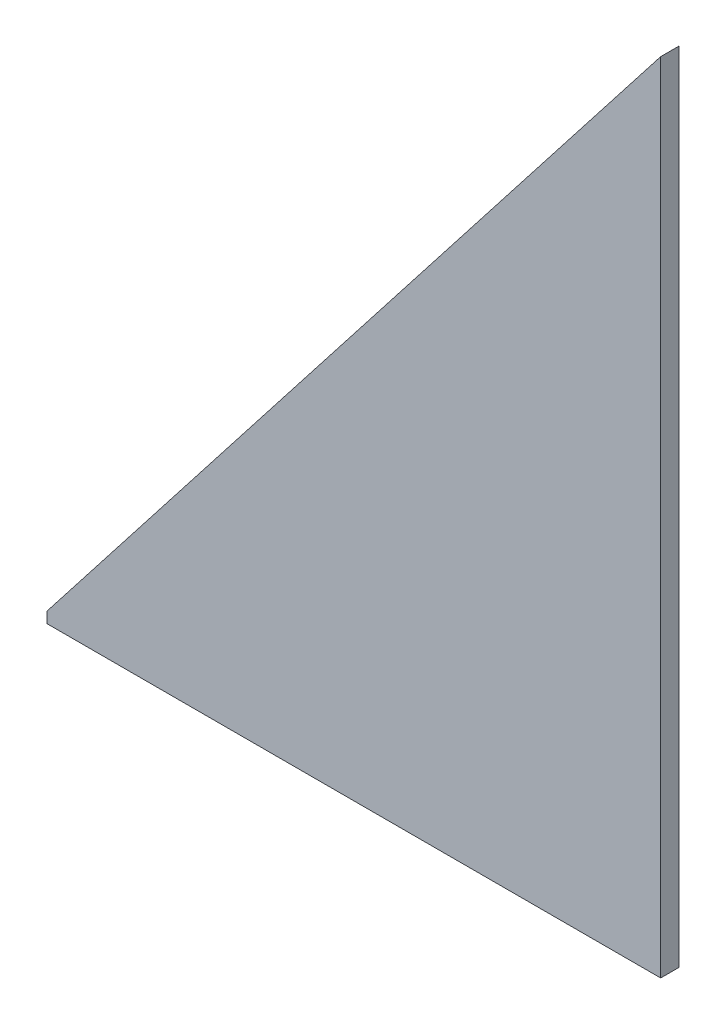
from build123d import *

# Parameters (mm, degrees)
SKETCH_1_W          = 100
SKETCH_1_H          = 130
EXTRUDE_1_DEPTH     = 3
CUT_EXTRUDE_5_DEPTH = 127.381402242


with BuildPart() as part:
    # 草图1 → 凸台-拉伸1 (new body)
    with BuildSketch(Plane.XY):
        with Locations((-27.81018426, -34.543126624)):
            Rectangle(SKETCH_1_W, SKETCH_1_H)
    extrude(amount=EXTRUDE_1_DEPTH)

    # 草图2 → 切除-拉伸5 (cut, through all)
    with BuildSketch(Plane.XY):
        Polygon((-77.81018426, 30.456873376), (22.18981574, 30.456873376), (-77.81018426, -97.789660723), align=None)
    extrude(amount=CUT_EXTRUDE_5_DEPTH, mode=Mode.SUBTRACT)


solid = part.part
